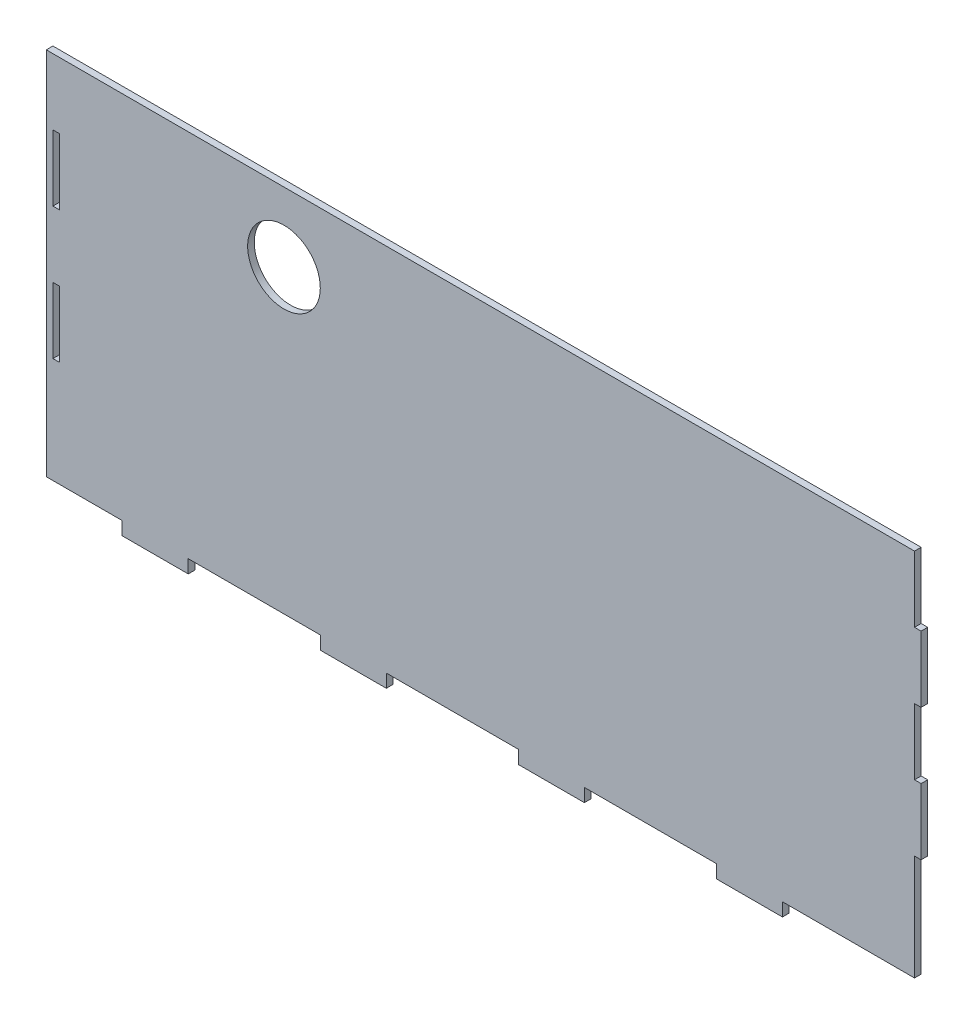
from build123d import *

# Parameters (mm, degrees)
SKETCH1_R           = 11
BOSS_EXTRUDE1_DEPTH = 2
SKETCH2_W           = 2
SKETCH2_H           = 20
CUT_EXTRUDE1_DEPTH  = 10


with BuildPart() as part:
    # Sketch1 → Boss-Extrude1 (new body)
    with BuildSketch(Plane.XY):
        Polygon((11.5, -56), (11.5, -60), (31.5, -60), (31.5, -56), (71.5, -56), (71.5, -60), (91.5, -60), (91.5, -56), (131.5, -56), (131.5, -24), (133.5, -24), (133.5, -4), (131.5, -4), (131.5, 16), (133.5, 16), (133.5, 36), (131.5, 36), (131.5, 56), (-131.5, 56), (-131.5, 36), (-131.5, 16), (-131.5, -4), (-131.5, -24), (-131.5, -56), (-108.5, -56), (-108.5, -60), (-88.5, -60), (-88.5, -56), (-48.5, -56), (-48.5, -60), (-28.5, -60), (-28.5, -56), align=None)
        with Locations((-59.5, 35)):
            Circle(SKETCH1_R, mode=Mode.SUBTRACT)
    extrude(amount=BOSS_EXTRUDE1_DEPTH)

    # Sketch2 → Cut-Extrude1 (cut)
    with BuildSketch(Plane.XY.offset(2)):
        with Locations((-128.5, 26)):
            Rectangle(SKETCH2_W, SKETCH2_H)
        with Locations((-128.5, -14)):
            Rectangle(SKETCH2_W, SKETCH2_H)
    extrude(amount=-CUT_EXTRUDE1_DEPTH, mode=Mode.SUBTRACT)


solid = part.part
